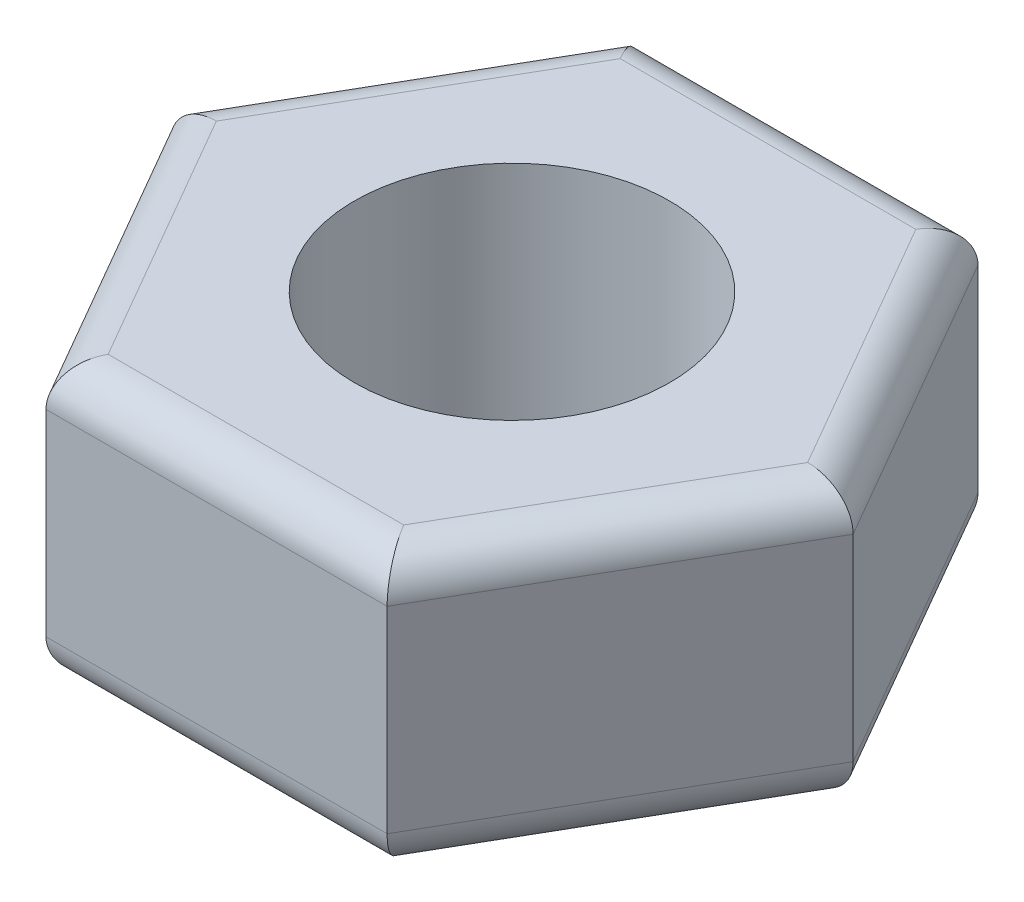
from build123d import *

# Parameters (mm, degrees)
SKETCH1_R           = 2
BOSS_EXTRUDE1_DEPTH = 3.5
FILLET1_R           = 0.5


with BuildPart() as part:
    # Sketch1 → Boss-Extrude1 (new body)
    with BuildSketch(Plane(origin=(0, 0, 0), x_dir=(1, 0, 0), z_dir=(0, 1, 0))):
        Polygon((2.165063509, 3.75), (-2.165063509, 3.75), (-4.330127019, 0), (-2.165063509, -3.75), (2.165063509, -3.75), (4.330127019, 0), align=None)
        with Locations(Location((0, 0, 0), (0, 0, 270))):
            Circle(SKETCH1_R, mode=Mode.SUBTRACT)
    extrude(amount=BOSS_EXTRUDE1_DEPTH)

    # Fillet1
    fillet1_edges = [part.edges().sort_by_distance(p)[0] for p in [
        (-3.247595264, 3.5, -1.875),
        (-3.247595264, 3.5, 1.875),
        (0, 3.5, 3.75),
        (3.247595264, 3.5, 1.875),
        (3.247595264, 3.5, -1.875),
        (3.247595264, 0, 1.875),
        (0, 0, 3.75),
        (-3.247595264, 0, 1.875),
        (-3.247595264, 0, -1.875),
        (0, 0, -3.75),
        (3.247595264, 0, -1.875),
        (0, 3.5, -3.75),
    ]]
    fillet(fillet1_edges, radius=FILLET1_R)


solid = part.part
